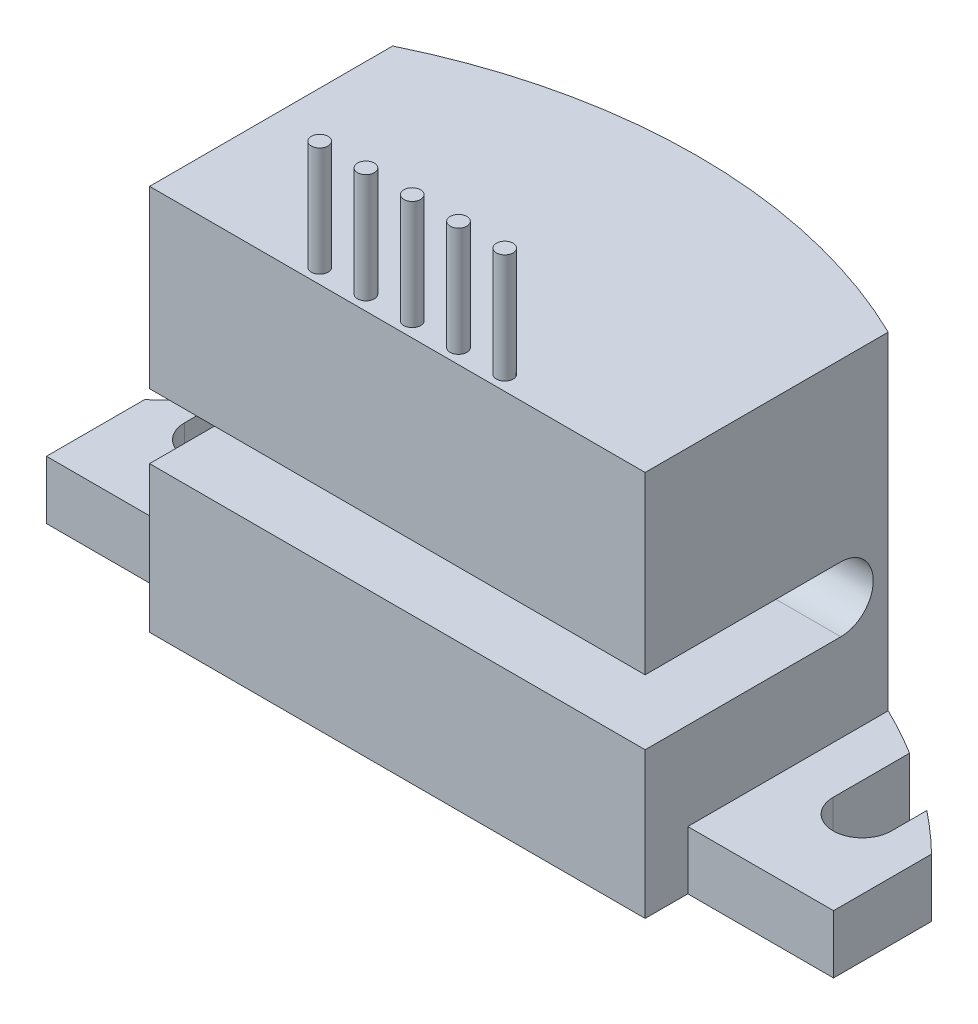
from build123d import *

# Parameters (mm, degrees)
BOSS_EXTRUDE1_DEPTH = 14.4
SKETCH2_R           = 11.81943886
SKETCH2_R_2         = 1
CUT_EXTRUDE1_DEPTH  = 0.8
SKETCH3_W           = 6.542631095
SKETCH3_H           = 5.500743834
SKETCH3_W_2         = 5.841537105
CUT_EXTRUDE2_DEPTH  = 12
CUT_EXTRUDE3_DEPTH  = 24.277671705
CUT_EXTRUDE4_DEPTH  = 28.520356102
SKETCH6_R           = 9.65525988
SKETCH6_R_2         = 0.23
CUT_EXTRUDE5_DEPTH  = 3


with BuildPart() as part:
    # Sketch1 → Boss-Extrude1 (new body)
    with BuildSketch(Plane(origin=(0, 0, 0), x_dir=(1, 0, 0), z_dir=(0, 1, 0))):
        with BuildLine():
            Line((-10.8, 11.118003418), (-10.8, 8.428003418))
            Line((-10.8, 8.428003418), (-6.8, 8.428003418))
            Line((-6.8, 8.428003418), (-6.8, 7.258003418))
            Line((-6.8, 7.258003418), (6.8, 7.258003418))
            Line((6.8, 7.258003418), (6.8, 8.428003418))
            Line((6.8, 8.428003418), (10.8, 8.428003418))
            Line((10.8, 8.428003418), (10.8, 11.118003418))
            ThreePointArc((10.8, 11.118003418), (0, 15.5), (-10.8, 11.118003418))
        make_face()
    extrude(amount=BOSS_EXTRUDE1_DEPTH)

    # Sketch2 → Cut-Extrude1 (cut)
    with BuildSketch(Plane.XZ):
        with Locations((0, -10.948003418)):
            Circle(SKETCH2_R)
        with Locations(Location((-6.4, -10.948003418, 0), (0, 0, 270))):
            Circle(SKETCH2_R_2, mode=Mode.SUBTRACT)
        with Locations(Location((6.4, -10.948003418, 0), (0, 0, 270))):
            Circle(SKETCH2_R_2, mode=Mode.SUBTRACT)
    extrude(amount=-CUT_EXTRUDE1_DEPTH, mode=Mode.SUBTRACT)

    # Sketch3 → Cut-Extrude2 (cut)
    with BuildSketch(Plane(origin=(0, 14.4, 0), x_dir=(1, 0, 0), z_dir=(0, 1, 0))):
        with Locations((-10.071315548, 11.178375335)):
            Rectangle(SKETCH3_W, SKETCH3_H)
        with Locations((9.720768553, 11.178375335)):
            Rectangle(SKETCH3_W_2, SKETCH3_H)
    extrude(amount=-CUT_EXTRUDE2_DEPTH, mode=Mode.SUBTRACT)

    # Sketch4 → Cut-Extrude3 (cut, through all)
    with BuildSketch(Plane.XZ.offset(-0.8)):
        with BuildLine():
            Line((9.7, -11.118003418), (9.7, -12.089665008))
            Line((9.7, -12.089665008), (9.7, -13.215142829))
            Line((9.7, -13.215142829), (8.1, -13.215142829))
            Line((8.1, -13.215142829), (8.1, -11.118003418))
            ThreePointArc((8.1, -11.118003418), (8.9, -10.318003418), (9.7, -11.118003418))
        make_face()
        with BuildLine():
            Line((-8.1, -11.118003418), (-8.1, -13.215142829))
            Line((-8.1, -13.215142829), (-9.7, -13.215142829))
            Line((-9.7, -13.215142829), (-9.7, -11.118003418))
            ThreePointArc((-9.7, -11.118003418), (-8.9, -10.318003418), (-8.1, -11.118003418))
        make_face()
    extrude(amount=-CUT_EXTRUDE3_DEPTH, mode=Mode.SUBTRACT)

    # Sketch5 → Cut-Extrude4 (cut, through all)
    with BuildSketch(Plane.ZY.offset(6.8)):
        with BuildLine():
            Line((-12.628003418, 6.59), (-7.258003418, 6.59))
            Line((-7.258003418, 6.59), (-7.258003418, 4.81))
            Line((-7.258003418, 4.81), (-12.628003418, 4.81))
            ThreePointArc((-12.628003418, 4.81), (-13.518003418, 5.7), (-12.628003418, 6.59))
        make_face()
    extrude(amount=-CUT_EXTRUDE4_DEPTH, mode=Mode.SUBTRACT)

    # Sketch6 → Cut-Extrude5 (cut)
    with BuildSketch(Plane(origin=(0, 14.4, 0), x_dir=(1, 0, 0), z_dir=(0, 1, 0))):
        with Locations((0, 7.666269644)):
            Circle(SKETCH6_R)
        with Locations(Location((0, 7.666269644, 0), (0, 0, 270))):
            Circle(SKETCH6_R_2, mode=Mode.SUBTRACT)
        with Locations(Location((1.27, 7.666269644, 0), (0, 0, 270))):
            Circle(SKETCH6_R_2, mode=Mode.SUBTRACT)
        with Locations(Location((2.54, 7.666269644, 0), (0, 0, 270))):
            Circle(SKETCH6_R_2, mode=Mode.SUBTRACT)
        with Locations(Location((-1.27, 7.666269644, 0), (0, 0, 270))):
            Circle(SKETCH6_R_2, mode=Mode.SUBTRACT)
        with Locations(Location((-2.54, 7.666269644, 0), (0, 0, 270))):
            Circle(SKETCH6_R_2, mode=Mode.SUBTRACT)
    extrude(amount=-CUT_EXTRUDE5_DEPTH, mode=Mode.SUBTRACT)


solid = part.part
